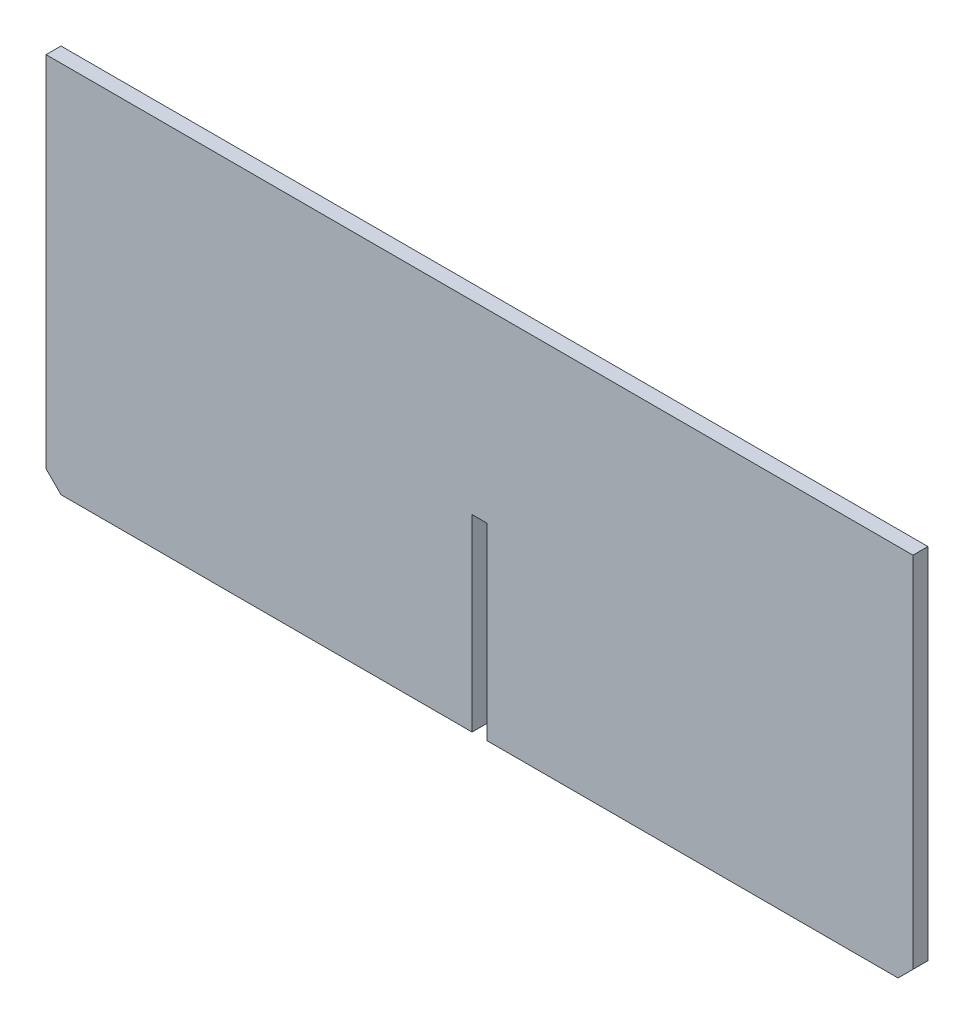
from build123d import *

# Parameters (mm, degrees)
SKETCH_1_W          = 116
SKETCH_1_H          = 50
EXTRUDE_1_DEPTH     = 2
CHAMFER_1_SIZE      = 2
SKETCH_2_W          = 2
SKETCH_2_H          = 25.2
CUT_EXTRUDE_1_DEPTH = 127.332893579


with BuildPart() as part:
    # 草图1 → 凸台-拉伸1 (new body)
    with BuildSketch(Plane.XY):
        with Locations((58, -25)):
            Rectangle(SKETCH_1_W, SKETCH_1_H)
    extrude(amount=EXTRUDE_1_DEPTH)

    # 倒角1
    chamfer_1_edges = [part.edges().sort_by_distance(p)[0] for p in [
        (116, -50, 1),
        (0, -50, 1),
    ]]
    chamfer(chamfer_1_edges, length=CHAMFER_1_SIZE)

    # 草图2 → 切除-拉伸1 (cut, through all)
    with BuildSketch(Plane(origin=(0, 0, 0), x_dir=(-1, 0, 0), z_dir=(0, 0, -1))):
        with Locations((-58, -37.4)):
            Rectangle(SKETCH_2_W, SKETCH_2_H)
    extrude(amount=-CUT_EXTRUDE_1_DEPTH, mode=Mode.SUBTRACT)


solid = part.part
